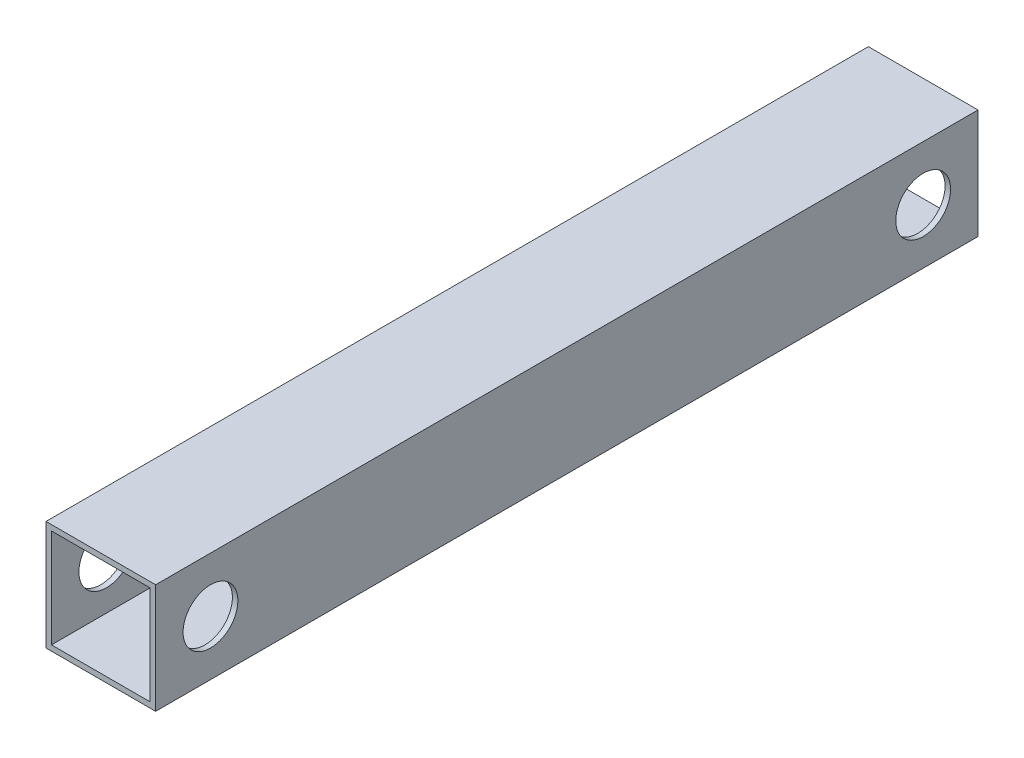
from build123d import *

# Parameters (mm, degrees)
SKETCH1_W           = 20
SKETCH1_H           = 20
SKETCH1_W_2         = 18
SKETCH1_H_2         = 18
BOSS_EXTRUDE1_DEPTH = 150
SKETCH2_R           = 5
CUT_EXTRUDE1_DEPTH  = 150


with BuildPart() as part:
    # Sketch1 → Boss-Extrude1 (new body)
    with BuildSketch(Plane.XY):
        Rectangle(SKETCH1_W, SKETCH1_H)
        Rectangle(SKETCH1_W_2, SKETCH1_H_2, mode=Mode.SUBTRACT)
    extrude(amount=BOSS_EXTRUDE1_DEPTH)

    # Sketch2 → Cut-Extrude1 (cut)
    with BuildSketch(Plane(origin=(10, 0, 0), x_dir=(0, 0, -1), z_dir=(1, 0, 0))):
        with Locations((-140, 0)):
            Circle(SKETCH2_R)
        with Locations((-10, 0)):
            Circle(SKETCH2_R)
    extrude(amount=-CUT_EXTRUDE1_DEPTH, mode=Mode.SUBTRACT)


solid = part.part
